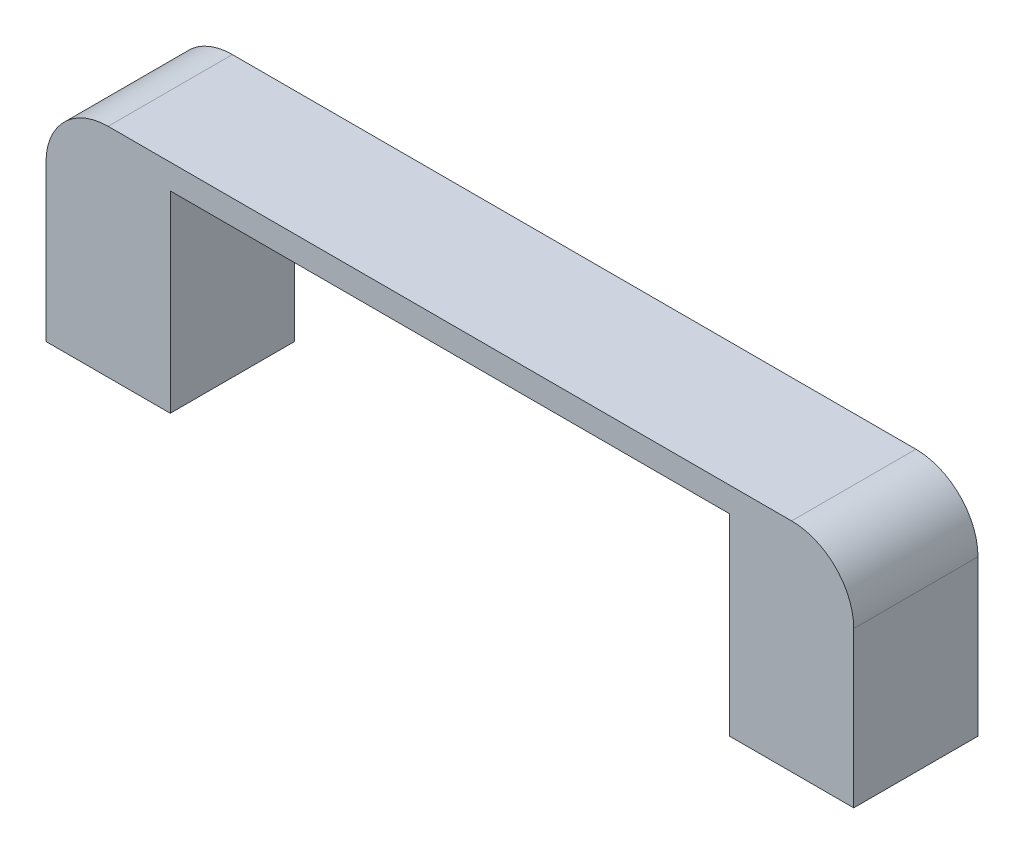
from build123d import *

# Parameters (mm, degrees)
CROQUIS1_W                = 10
CROQUIS1_H                = 10
SALIENTE_EXTRUIR1_DEPTH   = 15.5
SALIENTE_EXTRUIR1_2_DEPTH = 15.5
CROQUIS5_W                = 65
CROQUIS5_H                = 10
SALIENTE_EXTRUIR4_DEPTH   = 2
CROQUIS6_R                = 1.5
CORTAR_EXTRUIR2_DEPTH     = 5
REDONDEO1_R               = 5


with BuildPart() as part:
    # Croquis1 → Saliente-Extruir1 (new body)
    with BuildSketch(Plane(origin=(0, 0, 0), x_dir=(1, 0, 0), z_dir=(0, 1, 0))):
        with Locations((-27.5, 5)):
            Rectangle(CROQUIS1_W, CROQUIS1_H)
    extrude(amount=SALIENTE_EXTRUIR1_DEPTH)



with BuildPart() as body_2:
    # Croquis1 → Saliente-Extruir1 2 (new body)
    with BuildSketch(Plane(origin=(0, 0, 0), x_dir=(1, 0, 0), z_dir=(0, 1, 0))):
        with Locations((27.5, 5)):
            Rectangle(CROQUIS1_W, CROQUIS1_H)
    extrude(amount=SALIENTE_EXTRUIR1_2_DEPTH)


with BuildPart() as part_1:
    add(part.part)

    add(body_2.part)  # Saliente-Extruir4 merges body 2
    # Croquis5 → Saliente-Extruir4 (add)
    with BuildSketch(Plane(origin=(0, 15.5, 0), x_dir=(1, 0, 0), z_dir=(0, 1, 0))):
        with Locations((0, 5)):
            Rectangle(CROQUIS5_W, CROQUIS5_H)
    extrude(amount=SALIENTE_EXTRUIR4_DEPTH)

    # Croquis6 → Cortar-Extruir2 (cut)
    with BuildSketch(Plane.XZ):
        with Locations(Location((-27.5, -5, 0), (0, 0, 270))):
            Circle(CROQUIS6_R)
        with Locations(Location((27.5, -5, 0), (0, 0, 270))):
            Circle(CROQUIS6_R)
    extrude(amount=-CORTAR_EXTRUIR2_DEPTH, mode=Mode.SUBTRACT)

    # Redondeo1
    redondeo1_edges = [part_1.edges().sort_by_distance(p)[0] for p in [
        (-32.5, 17.5, -5),
        (32.5, 17.5, -5),
    ]]
    fillet(redondeo1_edges, radius=REDONDEO1_R)


solid = part_1.part
